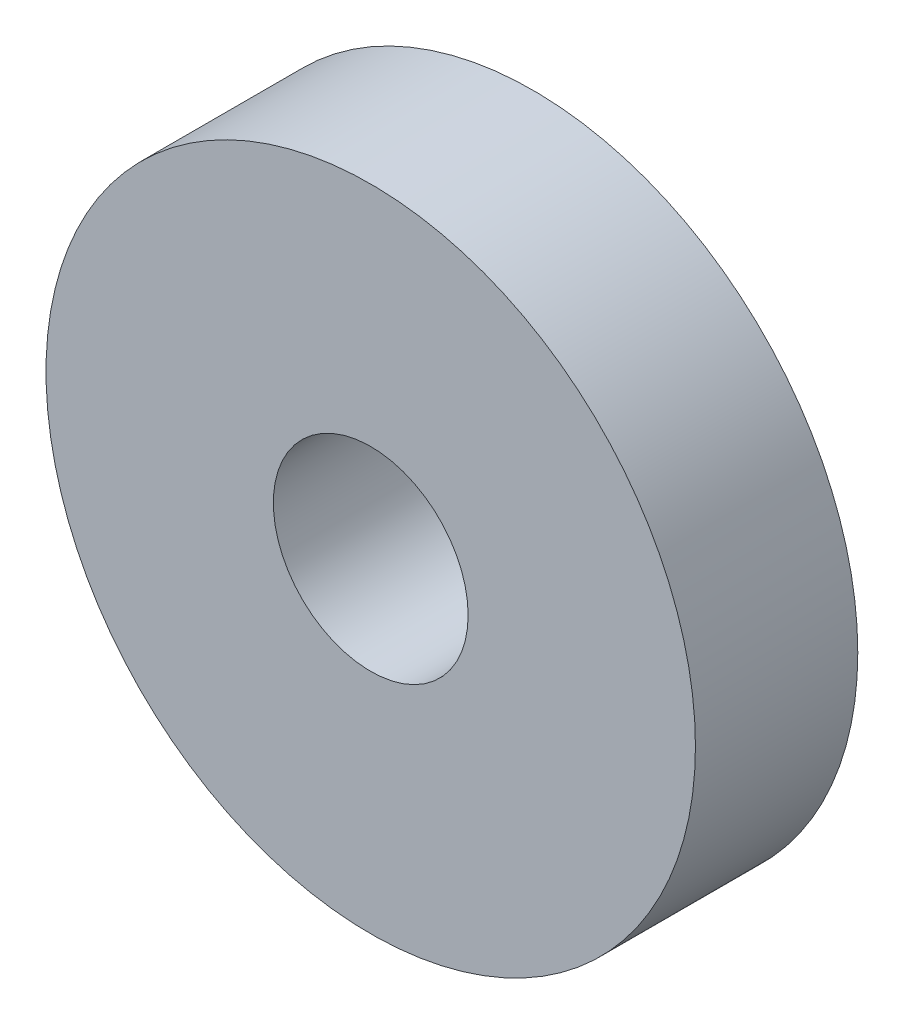
from build123d import *

# Parameters (mm, degrees)
ESQUISSE1_R             = 10
BOSS_EXTRU_1_DEPTH      = 5
ESQUISSE2_R             = 3
ENL_V_MAT_EXTRU_1_DEPTH = 16


with BuildPart() as part:
    # Esquisse1 → Boss.-Extru.1 (new body)
    with BuildSketch(Plane.XY):
        Circle(ESQUISSE1_R)
    extrude(amount=BOSS_EXTRU_1_DEPTH)

    # Esquisse2 → Enlèv. mat.-Extru.1 (cut, through all)
    with BuildSketch(Plane.XY.offset(5)):
        Circle(ESQUISSE2_R)
    extrude(amount=-ENL_V_MAT_EXTRU_1_DEPTH, mode=Mode.SUBTRACT)


solid = part.part
